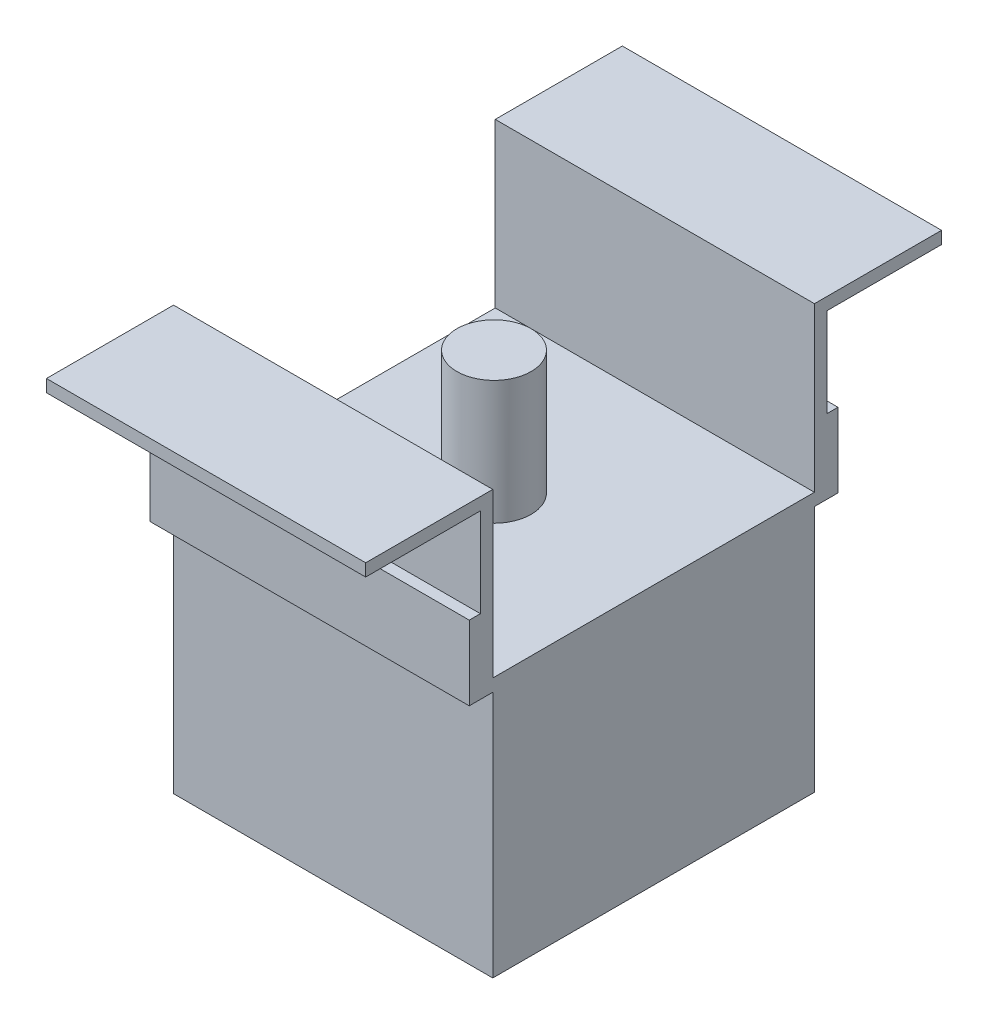
from build123d import *

# Parameters (mm, degrees)
SKETCH1_W           = 12.9
SKETCH1_H           = 13
BOSS_EXTRUDE1_DEPTH = 10
BOSS_EXTRUDE2_DEPTH = 12.9
SKETCH3_W           = 0.45
SKETCH3_H           = 3
BOSS_EXTRUDE3_DEPTH = 12.9
SKETCH4_R           = 1.5
BOSS_EXTRUDE4_DEPTH = 5


with BuildPart() as part:
    # Sketch1 → Boss-Extrude1 (new body)
    with BuildSketch(Plane(origin=(0, 0, 0), x_dir=(1, 0, 0), z_dir=(0, 1, 0))):
        with Locations((6.45, 6.5)):
            Rectangle(SKETCH1_W, SKETCH1_H)
    extrude(amount=BOSS_EXTRUDE1_DEPTH)

    # Sketch2 → Boss-Extrude2 (add)
    with BuildSketch(Plane(origin=(12.9, 0, 0), x_dir=(0, 0, -1), z_dir=(1, 0, 0))):
        Polygon((6.5, 10), (6.5, 10.5), (0, 10.5), (0, 17.1), (-5.135999104, 17.1), (-5.135999104, 16.6), (-0.5, 16.6), (-0.5, 10), (0, 10), align=None)
        Polygon((13, 17.1), (13, 10.5), (6.5, 10.5), (6.5, 10), (13, 10), (13.5, 10), (13.5, 16.6), (18.135999104, 16.6), (18.135999104, 17.1), align=None)
    extrude(amount=-BOSS_EXTRUDE2_DEPTH)

    # Sketch3 → Boss-Extrude3 (add)
    with BuildSketch(Plane(origin=(12.9, 0, 0), x_dir=(0, 0, -1), z_dir=(1, 0, 0))):
        with Locations((-0.725, 11.5)):
            Rectangle(SKETCH3_W, SKETCH3_H)
        with Locations((13.725, 11.5)):
            Rectangle(SKETCH3_W, SKETCH3_H)
    extrude(amount=-BOSS_EXTRUDE3_DEPTH)

    # Sketch4 → Boss-Extrude4 (add)
    with BuildSketch(Plane(origin=(0, 10.5, 0), x_dir=(1, 0, 0), z_dir=(0, 1, 0))):
        with Locations(Location((6.45, 6.5, 0), (0, 0, 90))):
            Circle(SKETCH4_R)
    extrude(amount=BOSS_EXTRUDE4_DEPTH)


solid = part.part
